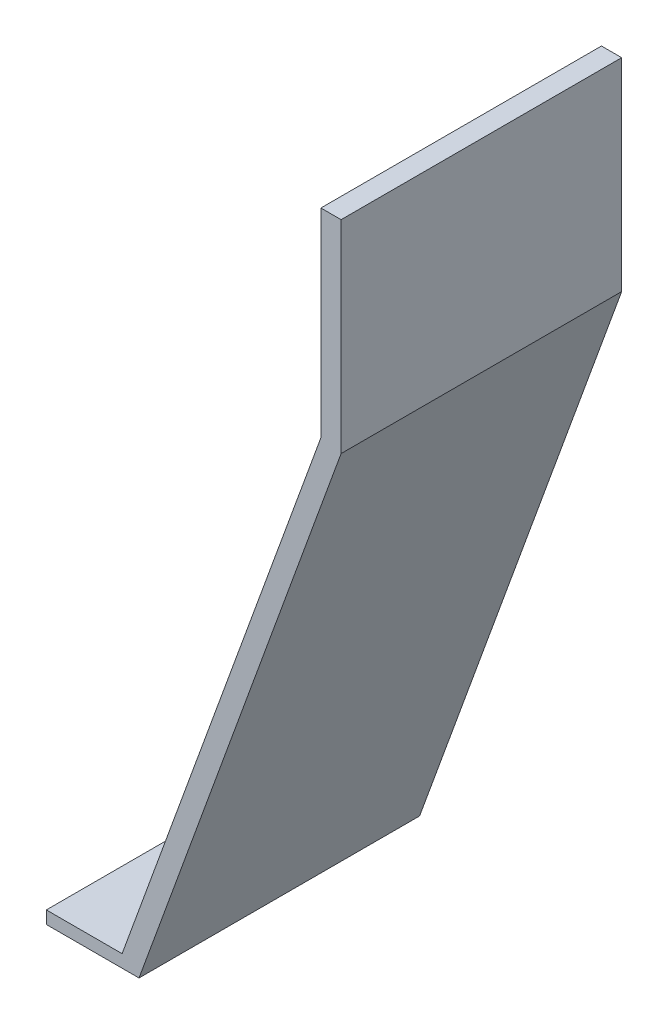
from build123d import *

# Parameters (mm, degrees)
SALIENTE_EXTRUIR1_DEPTH = 55.54


with BuildPart() as part:
    # Croquis1 → Saliente-Extruir1 (new body)
    with BuildSketch(Plane.XY):
        Polygon((0, 0), (18.346785504, 0), (58.346785504, 109.899096778), (58.346785504, 150), (54.346785504, 150), (54.346785504, 110.604404701), (15, 2.5), (0, 2.5), align=None)
    extrude(amount=SALIENTE_EXTRUIR1_DEPTH)


solid = part.part
